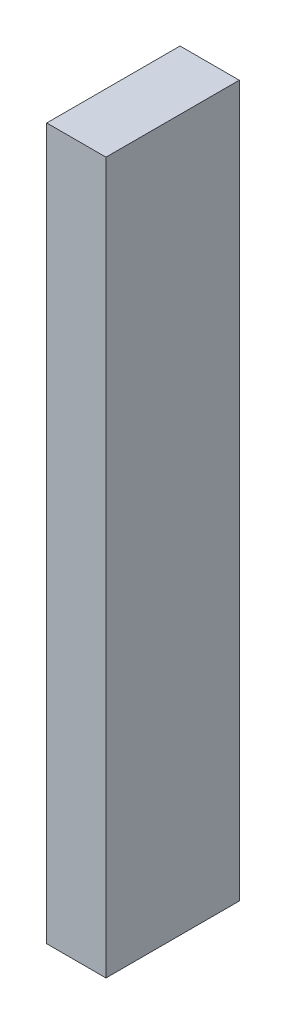
from build123d import *

# Parameters (mm, degrees)
SKETCH1_W           = 12.7
SKETCH1_H           = 152.4
BOSS_EXTRUDE1_DEPTH = 28.575


with BuildPart() as part:
    # Sketch1 → Boss-Extrude1 (new body)
    with BuildSketch(Plane.XY):
        with Locations((-120.138766336, -387.35)):
            Rectangle(SKETCH1_W, SKETCH1_H)
    extrude(amount=BOSS_EXTRUDE1_DEPTH)


solid = part.part
